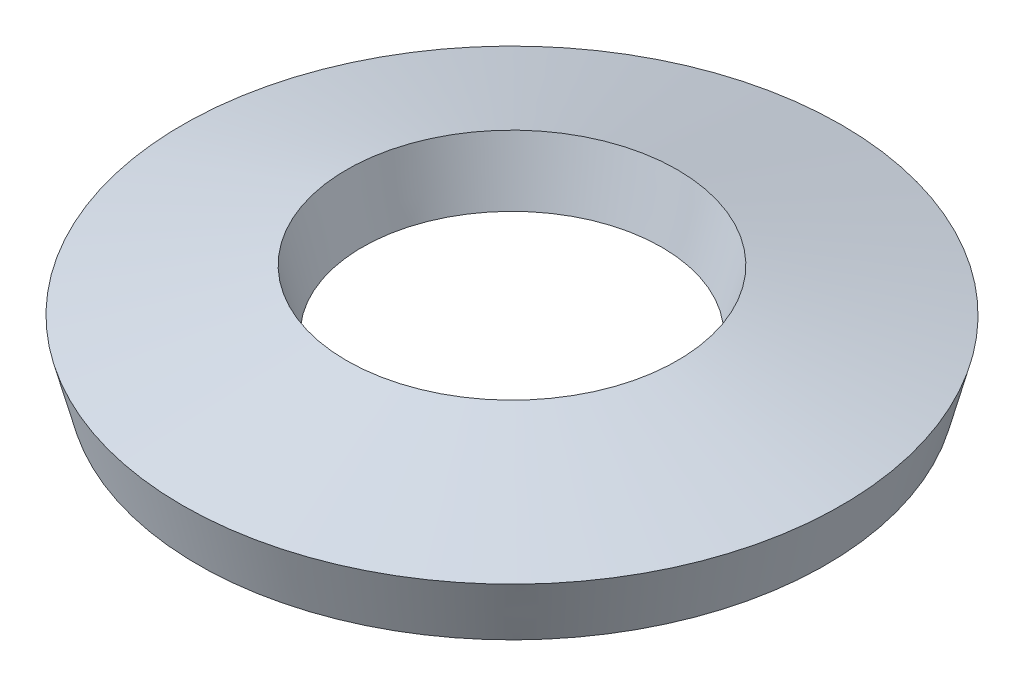
from build123d import *


with BuildPart() as part:
    # Sketch1 → Revolve1 (revolve)
    with BuildSketch(Plane.XY, mode=Mode.PRIVATE) as revolve1_sk:
        Polygon((6.762507097, 0), (3.2258, 0.932661331), (3.562592903, 2.2098), (7.0993, 1.277138669), align=None)
    revolve(revolve1_sk.sketch.rotate(Axis((0, 0, 0), (0, 1, 0)), 90), axis=Axis((0, 0, 0), (0, 1, 0)))


solid = part.part
